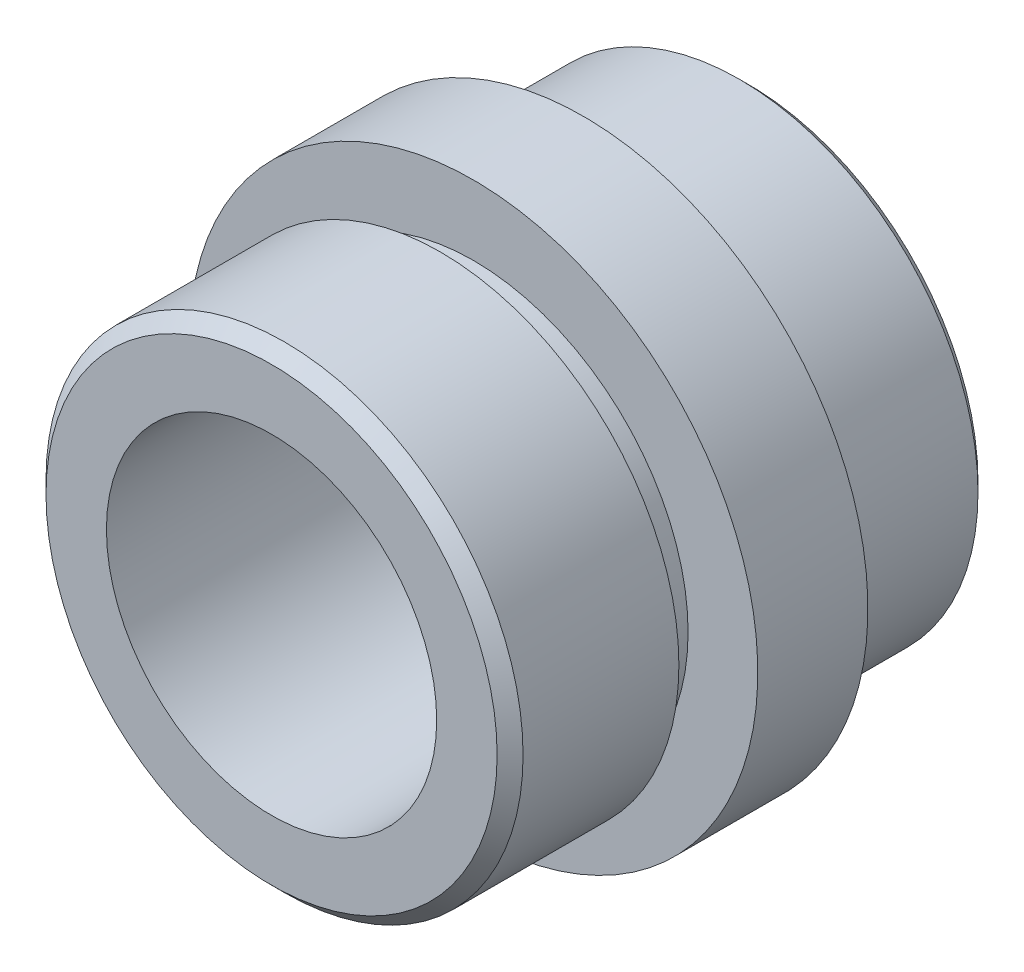
from build123d import *


with BuildPart() as part:
    # Эскиз1 → Повернуть1 (revolve)
    with BuildSketch(Plane.XZ, mode=Mode.PRIVATE) as revolve_1_sk:
        Polygon((11.7, 16.8), (13, 16.8), (13, 25.292893219), (12.292893219, 26), (9, 26), (9, 1), (10, 0), (12.5, 0), (13, 0.5), (13, 7.7), (11.7, 7.7), (11.7, 9), (15.5, 9), (15.5, 15), (11.7, 15), align=None)
    revolve(revolve_1_sk.sketch.rotate(Axis((0, 0, 26.005), (0, 0, -1)), 180), axis=Axis((0, 0, 26.005), (0, 0, -1)))


solid = part.part
